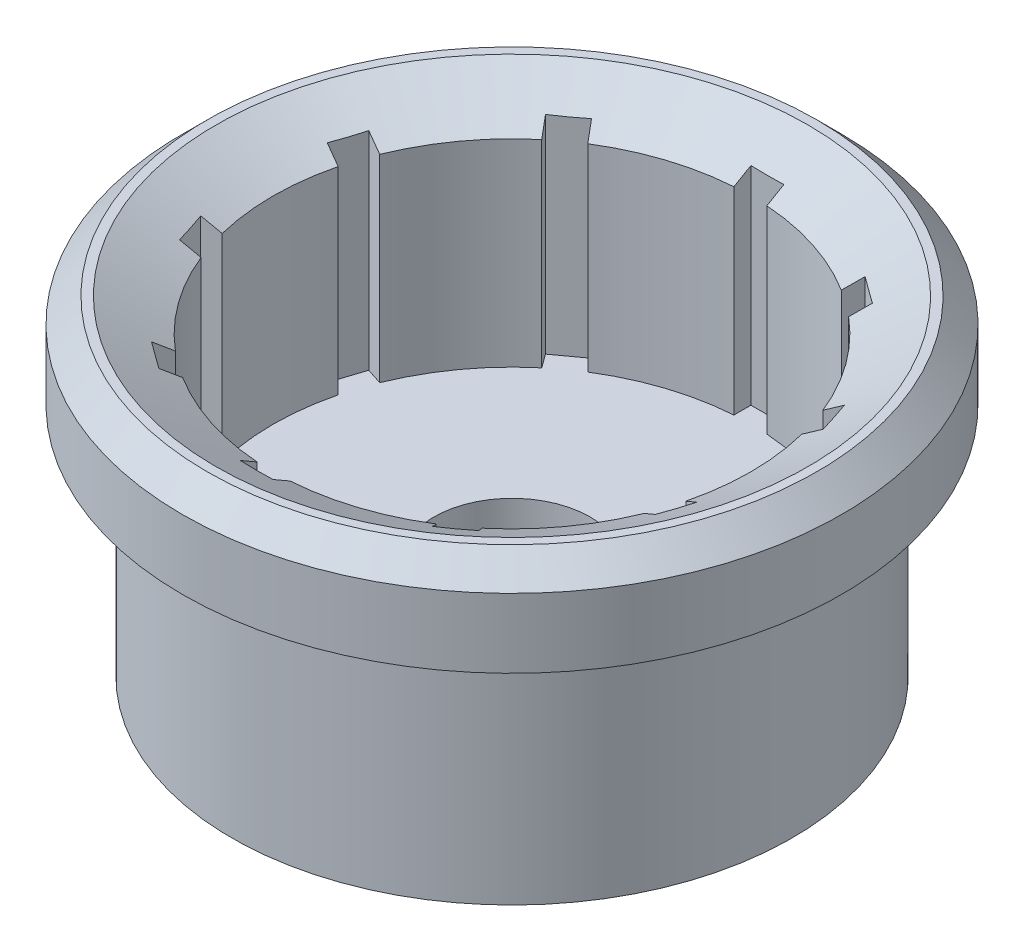
from build123d import *

# Parameters (mm, degrees)
CHAMFER_1_SIZE           = 2
CHAMFER_1_SIZE2          = 3.464101615
CHAMFER_2_SIZE           = 1.5
SKETCH_2_W               = 2
SKETCH_2_H               = 31
CUT_EXTRUDE_1_DEPTH      = 32.559467676
PATTERN_CIRCULAR_1_COUNT = 10
CHAMFER_3_SIZE           = 1
CHAMFER_4_SIZE           = 0.2
CUT_EXTRUDE_2_DEPTH      = 0.3


with BuildPart() as part:
    # 草图1 → 旋转1 (revolve)
    with BuildSketch(Plane.XY, mode=Mode.PRIVATE) as revolve_1_sk:
        Polygon((-2.5, 0), (-2.5, 8), (-4.75, 8), (-4.75, 12), (-14.5, 12), (-14.5, 26), (-20, 26), (-20, 20.3), (-17, 20.3), (-17, 6), (-6.5, 6), (-6.5, 5), (-4.5, 5), (-4.5, 0), align=None)
    revolve(revolve_1_sk.sketch.rotate(Axis((0, 0, 0), (0, 1, 0)), 270), axis=Axis((0, 0, 0), (0, 1, 0)))

    # 倒角1
    chamfer_1_edges = [part.edges().sort_by_distance(p)[0] for p in [
        (0, 26, 14.5),
    ]]
    chamfer_1_side = [part.faces().sort_by_distance(p)[0] for p in [
        (0, 19, 14.5),
    ]]
    chamfer(chamfer_1_edges, length=CHAMFER_1_SIZE, length2=CHAMFER_1_SIZE2, reference=chamfer_1_side[0])

    # 倒角2
    chamfer_2_edges = [part.edges().sort_by_distance(p)[0] for p in [
        (0, 26, 20),
    ]]
    chamfer(chamfer_2_edges, length=CHAMFER_2_SIZE)

    # 草图2 → 切除-拉伸1 (cut, through all)
    with BuildSketch(Plane(origin=(0, 12, 0), x_dir=(1, 0, 0), z_dir=(0, 1, 0))):
        Rectangle(SKETCH_2_W, SKETCH_2_H)
    cut_extrude_1 = extrude(amount=CUT_EXTRUDE_1_DEPTH, mode=Mode.SUBTRACT)

    # 阵列(圆周)1: 切除-拉伸1 ×10 about axis
    pattern_circular_1_axis = Axis((0, 0, 0), (0, 1, 0))
    for i in range(1, PATTERN_CIRCULAR_1_COUNT):
        add(cut_extrude_1.rotate(pattern_circular_1_axis, i * 360 / PATTERN_CIRCULAR_1_COUNT), mode=Mode.SUBTRACT)

    # 倒角3
    chamfer_3_edges = [part.edges().sort_by_distance(p)[0] for p in [
        (0, 0, 4.5),
    ]]
    chamfer(chamfer_3_edges, length=CHAMFER_3_SIZE)

    # 倒角4
    chamfer_4_edges = [part.edges().sort_by_distance(p)[0] for p in [
        (0, 5, 6.5),
    ]]
    chamfer(chamfer_4_edges, length=CHAMFER_4_SIZE)

    # 草图3 → 切除-拉伸2 (cut)
    # profile 1 of 12: a face of its own
    with BuildSketch(Plane(origin=(0, 12, 0), x_dir=(1, 0, 0), z_dir=(0, 1, 0))):
        Polygon((3.14620718, 6.849376504), (2.409069223, 7.132341443), (2.945559314, 8.529730924), (3.126199558, 8.460275894), (2.651161448, 7.222661565), (3.207659162, 7.009151656), align=None)
    # profile 2 of 12: a face of its own
    with BuildSketch(Plane(origin=(0, 12, 0), x_dir=(1, 0, 0), z_dir=(0, 1, 0))):
        with BuildLine():
            add(Edge.make_bspline(
                [(4.357208409, 6.263600457), (4.335849155, 6.264257805), (4.29320875, 6.265570096), (4.229569589, 6.27283597), (4.166536035, 6.284776925), (4.103718409, 6.300367689), (4.041417444, 6.320793385), (3.979583811, 6.345461461), (3.918161426, 6.374319693), (3.878324794, 6.396642357), (3.858161152, 6.407941159)],
                knots=[0, 0, 0, 0, 0.975863205, 1.94815813, 2.92212701, 3.904856651, 4.902687482, 5.914533597, 6.94442389, 8, 8, 8, 8], degree=3))
            add(Edge.make_bspline(
                [(3.858161152, 6.407941159), (3.835687339, 6.421729576), (3.791775473, 6.448670936), (3.731743833, 6.495219681), (3.678015999, 6.544837572), (3.631130188, 6.598339251), (3.590769065, 6.65525821), (3.557123824, 6.71580237), (3.530511187, 6.780131335), (3.510216582, 6.847317171), (3.497124085, 6.91668572), (3.491262714, 6.987009404), (3.493406481, 7.057921694), (3.503035969, 7.12930458), (3.519639116, 7.201437133), (3.544184082, 7.27392872), (3.576416165, 7.346868778), (3.602641742, 7.394318299), (3.616068927, 7.41861189)],
                knots=[0, 0, 0, 0, 1.079629307, 2.109501173, 3.106617786, 4.072054532, 5.018674735, 5.960501731, 6.903686851, 7.865739862, 8.831176608, 9.790755451, 10.751445286, 11.731956575, 12.737595058, 13.779470977, 14.863115492, 16, 16, 16, 16], degree=3))
            add(Edge.make_bspline(
                [(3.616068927, 7.41861189), (3.630785411, 7.442625271), (3.659709664, 7.489821942), (3.709685155, 7.554382582), (3.763385035, 7.612232114), (3.820833922, 7.663565754), (3.882365513, 7.70803157), (3.948101538, 7.745369421), (4.017571712, 7.776174014), (4.090536746, 7.799582213), (4.165215815, 7.816369617), (4.240564952, 7.824583343), (4.315638193, 7.82516334), (4.390614353, 7.818152632), (4.465330656, 7.802326751), (4.539893868, 7.779060226), (4.614367754, 7.747915076), (4.662131573, 7.721386503), (4.686476701, 7.707864939)],
                knots=[0, 0, 0, 0, 1.086340946, 2.135129459, 3.144621878, 4.129120064, 5.103721325, 6.068800588, 7.04175647, 8.03132997, 9.021641019, 9.990921207, 10.950668867, 11.914780941, 12.891225611, 13.892588733, 14.925856483, 16, 16, 16, 16], degree=3))
            add(Edge.make_bspline(
                [(4.686476701, 7.707864939), (4.703433924, 7.697726322), (4.736654389, 7.677864014), (4.784004752, 7.646042212), (4.827898328, 7.612994897), (4.869317113, 7.579912286), (4.906766954, 7.544977742), (4.941417665, 7.509612211), (4.973106606, 7.473449245), (4.991721465, 7.447999672), (5.000882189, 7.435475457)],
                knots=[0, 0, 0, 0, 1.131230688, 2.216165348, 3.264757557, 4.277011034, 5.249936384, 6.195163007, 7.111805634, 8, 8, 8, 8], degree=3))
            Line((5.000882189, 7.435475457), (4.895985085, 7.255978506))
            add(Edge.make_bspline(
                [(4.895985085, 7.255978506), (4.887471819, 7.2714697), (4.870465118, 7.302416005), (4.840286147, 7.346314799), (4.80686702, 7.38843394), (4.76955521, 7.428522829), (4.728585366, 7.466533781), (4.684017586, 7.502605416), (4.636171507, 7.537054873), (4.602023747, 7.557658901), (4.584723652, 7.568097409)],
                knots=[0, 0, 0, 0, 0.949194624, 1.89617828, 2.857891985, 3.835843193, 4.835497204, 5.857995623, 6.914807918, 8, 8, 8, 8], degree=3))
            add(Edge.make_bspline(
                [(4.584723652, 7.568097409), (4.567367151, 7.577692369), (4.533212737, 7.596573493), (4.479843527, 7.61837278), (4.426356606, 7.635061349), (4.372373632, 7.645385959), (4.318028763, 7.649653636), (4.263429429, 7.648184667), (4.208513871, 7.641036521), (4.153895406, 7.62776818), (4.100258228, 7.609403321), (4.048818775, 7.585219211), (3.999955448, 7.555616632), (3.953860268, 7.520477047), (3.910137001, 7.480351619), (3.869551887, 7.434404602), (3.831041595, 7.383568308), (3.808314172, 7.346597853), (3.796709171, 7.327720122)],
                knots=[0, 0, 0, 0, 1.027964646, 2.022846102, 2.984268154, 3.930260357, 4.867250688, 5.806571084, 6.758560005, 7.73429244, 8.717369047, 9.694564734, 10.67689572, 11.675208235, 12.696486531, 13.750031017, 14.85112835, 16, 16, 16, 16], degree=3))
            add(Edge.make_bspline(
                [(3.796709171, 7.327720122), (3.785651912, 7.307863013), (3.764114772, 7.269185675), (3.73747965, 7.210147691), (3.716649105, 7.152266628), (3.701927728, 7.095326852), (3.692951662, 7.039343576), (3.689650688, 6.984363018), (3.692495433, 6.930374847), (3.701412044, 6.877872417), (3.715709829, 6.827188121), (3.735172983, 6.778778689), (3.760277324, 6.733129534), (3.790478666, 6.690016999), (3.82589617, 6.649554336), (3.866389521, 6.611740688), (3.912195443, 6.576574404), (3.945616808, 6.555988908), (3.962772433, 6.545422104)],
                knots=[0, 0, 0, 0, 1.20418438, 2.345489834, 3.428362659, 4.460813323, 5.457846323, 6.428955382, 7.374575895, 8.316792747, 9.245544773, 10.160731388, 11.075945864, 12.000515416, 12.945340139, 13.920641244, 14.932637904, 16, 16, 16, 16], degree=3))
            add(Edge.make_bspline(
                [(3.962772433, 6.545422104), (3.974879196, 6.538488816), (3.998639231, 6.524881944), (4.035132715, 6.507716321), (4.070793565, 6.492215245), (4.106437439, 6.480077875), (4.141584938, 6.469895685), (4.17654503, 6.46249132), (4.211114154, 6.457455491), (4.234098395, 6.456262775), (4.245451549, 6.455673628)],
                knots=[0, 0, 0, 0, 1.116967907, 2.192096805, 3.228169125, 4.229689744, 5.205560439, 6.157446739, 7.08986374, 8, 8, 8, 8], degree=3))
            Line((4.245451549, 6.455673628), (4.448957646, 6.80380625))
            Line((4.448957646, 6.80380625), (4.169994232, 6.96701128))
            Line((4.169994232, 6.96701128), (4.256027006, 7.114210213))
            Line((4.256027006, 7.114210213), (4.701911152, 6.853539482))
            Line((4.701911152, 6.853539482), (4.357208409, 6.263600457))
        make_face()
    # profile 3 of 12: a face of its own
    with BuildSketch(Plane(origin=(0, 12, 0), x_dir=(1, 0, 0), z_dir=(0, 1, 0))):
        with BuildLine():
            Line((5.400150092, 5.26752716), (5.227227074, 5.415583563))
            Line((5.227227074, 5.415583563), (5.308686677, 5.892050788))
            add(Edge.make_bspline(
                [(5.308686677, 5.892050788), (5.310552499, 5.903570512), (5.31416989, 5.925904567), (5.318500979, 5.95839084), (5.321436018, 5.988707279), (5.322818407, 6.01684387), (5.323239085, 6.042879642), (5.322180045, 6.066851899), (5.319563936, 6.088705516), (5.314788571, 6.114898563), (5.304796259, 6.145512805), (5.286794322, 6.179501359), (5.262991576, 6.211401983), (5.243176633, 6.229627733), (5.232943537, 6.239040118)],
                knots=[0, 0, 0, 0, 1.120456416, 2.172303337, 3.146283936, 4.043942091, 4.876449295, 5.645741822, 6.345838471, 6.988147234, 8.200267024, 9.419648688, 10.667420656, 12, 12, 12, 12], degree=3))
            Line((5.232943537, 6.239040118), (5.127474787, 6.329646063))
            Line((5.127474787, 6.329646063), (4.718176007, 5.852035544))
            Line((4.718176007, 5.852035544), (4.571834543, 5.977226093))
            Line((4.571834543, 5.977226093), (5.54420497, 7.111658258))
            Line((5.54420497, 7.111658258), (5.889765183, 6.815545453))
            add(Edge.make_bspline(
                [(5.889765183, 6.815545453), (5.902981642, 6.80381054), (5.928748157, 6.780932415), (5.963681936, 6.744582797), (5.994161043, 6.707593412), (6.020313684, 6.67005747), (6.042260957, 6.631996743), (6.05949646, 6.593164982), (6.072469949, 6.553819195), (6.081123484, 6.514072748), (6.085163537, 6.474274706), (6.084585442, 6.434762248), (6.079508824, 6.395668762), (6.069300788, 6.35715312), (6.054614457, 6.31920285), (6.035240688, 6.281919337), (6.01141251, 6.244975409), (5.992425741, 6.221806002), (5.982657714, 6.209886154)],
                knots=[0, 0, 0, 0, 1.221258081, 2.380937626, 3.480422159, 4.530790761, 5.539524127, 6.512368191, 7.461955993, 8.398368965, 9.31833679, 10.220599372, 11.123990698, 12.03600517, 12.967868817, 13.930946562, 14.935544522, 16, 16, 16, 16], degree=3))
            add(Edge.make_bspline(
                [(5.982657714, 6.209886154), (5.974232602, 6.20040567), (5.957743712, 6.181851296), (5.930931212, 6.156958142), (5.903466925, 6.134821026), (5.875206978, 6.115632883), (5.846057226, 6.099396541), (5.815971226, 6.086316513), (5.785072307, 6.075747649), (5.753065302, 6.069179131), (5.720412991, 6.064635078), (5.686816019, 6.063695732), (5.652383897, 6.065311449), (5.617149894, 6.070376505), (5.580999843, 6.078036394), (5.544122397, 6.089106137), (5.506290132, 6.102765053), (5.481259266, 6.113882207), (5.46846183, 6.119566032)],
                knots=[0, 0, 0, 0, 1.071071041, 2.096206428, 3.08684952, 4.049123387, 4.978756645, 5.901533695, 6.817933689, 7.732103608, 8.657685245, 9.600056644, 10.567233763, 11.566765521, 12.604059882, 13.6865946, 14.817233977, 16, 16, 16, 16], degree=3))
            Line((5.46846183, 6.119566032), (5.465603598, 6.116136154))
            add(Edge.make_bspline(
                [(5.465603598, 6.116136154), (5.470221675, 6.10603328), (5.479367061, 6.086026102), (5.488875488, 6.054580565), (5.495768739, 6.022681511), (5.497988049, 5.995177697), (5.498238876, 5.971893377), (5.498138608, 5.952142436), (5.496323287, 5.930258775), (5.494972334, 5.906193751), (5.491755532, 5.880038614), (5.488517108, 5.851612515), (5.484176137, 5.821028498), (5.480787471, 5.800010079), (5.479037287, 5.789154447)],
                knots=[0, 0, 0, 0, 1.199103468, 2.374638546, 3.541712358, 4.719904422, 5.348013318, 6.058476303, 6.852898143, 7.719922151, 8.662451062, 9.699385696, 10.811774489, 12, 12, 12, 12], degree=3))
            Line((5.479037287, 5.789154447), (5.400150092, 5.26752716))
        make_face()
        with BuildLine():
            Line((5.580790336, 6.858418929), (5.237230885, 6.457694843))
            Line((5.237230885, 6.457694843), (5.410153903, 6.309352618))
            add(Edge.make_bspline(
                [(5.410153903, 6.309352618), (5.418437339, 6.302552411), (5.434730092, 6.289177034), (5.460389316, 6.271756565), (5.486601418, 6.257281162), (5.513284666, 6.245899086), (5.54020258, 6.236918715), (5.567480271, 6.230763589), (5.595205465, 6.228067921), (5.623047105, 6.22770595), (5.650783532, 6.230153673), (5.677654981, 6.236018145), (5.7036544, 6.244308644), (5.72861771, 6.255469198), (5.752409978, 6.269707434), (5.775527041, 6.286351542), (5.797480306, 6.306077127), (5.810912019, 6.32094647), (5.817737744, 6.32850277)],
                knots=[0, 0, 0, 0, 1.120339998, 2.203604986, 3.238120769, 4.246789005, 5.232964375, 6.202337217, 7.163998956, 8.14046306, 9.111063992, 10.068587754, 11.010695653, 11.960621139, 12.920939991, 13.905453055, 14.935593528, 16, 16, 16, 16], degree=3))
            add(Edge.make_bspline(
                [(5.817737744, 6.32850277), (5.823808728, 6.335811574), (5.835609036, 6.350017862), (5.850234609, 6.372961135), (5.862263737, 6.39598498), (5.871630677, 6.419410456), (5.877881375, 6.44312588), (5.881411373, 6.467194681), (5.881941016, 6.491568489), (5.879639684, 6.516214777), (5.874426814, 6.540942658), (5.866368677, 6.565559703), (5.855474366, 6.590059301), (5.841182976, 6.614087572), (5.824368371, 6.638236629), (5.804085173, 6.661866457), (5.78131985, 6.685693881), (5.764403418, 6.700669421), (5.755714116, 6.708361764)],
                knots=[0, 0, 0, 0, 1.041946852, 2.025255679, 2.979384037, 3.890119977, 4.788038229, 5.665008742, 6.554115262, 7.457315611, 8.376120575, 9.321903206, 10.295544947, 11.312475691, 12.385904317, 13.521315497, 14.726797784, 16, 16, 16, 16], degree=3))
            Line((5.755714116, 6.708361764), (5.580790336, 6.858418929))
        make_face(mode=Mode.SUBTRACT)
    # profile 4 of 12: a face of its own
    with BuildSketch(Plane(origin=(0, 12, 0), x_dir=(1, 0, 0), z_dir=(0, 1, 0))):
        with BuildLine():
            add(Edge.make_bspline(
                [(7.178616352, 4.796926463), (7.186431862, 4.802902439), (7.201693328, 4.814571818), (7.222440987, 4.833738976), (7.240182732, 4.854177975), (7.255481465, 4.875318721), (7.26796126, 4.897527649), (7.277405439, 4.920905127), (7.28423755, 4.945259011), (7.288615954, 4.970447389), (7.289902697, 4.996234113), (7.28887147, 5.022297514), (7.284733758, 5.048533097), (7.277947887, 5.074809956), (7.267868647, 5.101055148), (7.255711542, 5.127645455), (7.24047132, 5.154248299), (7.228664263, 5.17143581), (7.22263312, 5.180215335)],
                knots=[0, 0, 0, 0, 1.081742489, 2.112335041, 3.100057938, 4.053847712, 4.977993258, 5.894503079, 6.820013993, 7.755437585, 8.699972661, 9.65445292, 10.619231154, 11.615532279, 12.633475098, 13.707117586, 14.828776506, 16, 16, 16, 16], degree=3))
            add(Edge.make_bspline(
                [(7.22263312, 5.180215335), (7.213017006, 5.19247759), (7.19357558, 5.217268866), (7.158487518, 5.250230059), (7.118426583, 5.279688884), (7.073863927, 5.305873434), (7.025336659, 5.328364271), (6.973316103, 5.346768938), (6.918027124, 5.360427176), (6.879890732, 5.366205623), (6.860495162, 5.369144451)],
                knots=[0, 0, 0, 0, 0.889993607, 1.799348997, 2.741780266, 3.72836241, 4.749544964, 5.795363465, 6.878756511, 8, 8, 8, 8], degree=3))
            Line((6.860495162, 5.369144451), (7.009694858, 5.476899786))
            add(Edge.make_bspline(
                [(7.009694858, 5.476899786), (7.026909055, 5.473870716), (7.061028533, 5.467866935), (7.110642863, 5.453580612), (7.157837521, 5.434153014), (7.203193838, 5.410313946), (7.246682627, 5.38099312), (7.288114954, 5.345272806), (7.3280283, 5.303557943), (7.351855669, 5.271940703), (7.364115589, 5.255672652)],
                knots=[0, 0, 0, 0, 0.974703229, 1.931915014, 2.873592798, 3.817563103, 4.786159838, 5.792805615, 6.864330047, 8, 8, 8, 8], degree=3))
            add(Edge.make_bspline(
                [(7.364115589, 5.255672652), (7.3735781, 5.242095473), (7.392071883, 5.21555987), (7.415505532, 5.174209936), (7.434860344, 5.132967541), (7.449750333, 5.091599134), (7.460791216, 5.0503233), (7.467438811, 5.008948573), (7.469649275, 4.96757641), (7.468037496, 4.926490392), (7.462137254, 4.886299614), (7.451724472, 4.847567653), (7.437118586, 4.810663914), (7.41832767, 4.775318702), (7.395115502, 4.741914231), (7.367555508, 4.710394893), (7.33648225, 4.679950789), (7.312793297, 4.662231144), (7.300662845, 4.653157408)],
                knots=[0, 0, 0, 0, 1.162112506, 2.271263818, 3.334319757, 4.359073078, 5.355903541, 6.331956145, 7.297278132, 8.261950165, 9.216115763, 10.144822203, 11.073287415, 11.998538303, 12.951012117, 13.923846451, 14.936859778, 16, 16, 16, 16], degree=3))
            add(Edge.make_bspline(
                [(7.300662845, 4.653157408), (7.289524173, 4.64537523), (7.267598475, 4.630056557), (7.233371344, 4.610145508), (7.199121509, 4.592529362), (7.164378191, 4.577993517), (7.129575624, 4.56588352), (7.094390521, 4.556709146), (7.059063315, 4.550101514), (7.023125169, 4.546271198), (6.986056441, 4.545665156), (6.947100654, 4.546977976), (6.905950591, 4.551350448), (6.862811099, 4.558739135), (6.817446588, 4.568064443), (6.770113696, 4.580522315), (6.72053359, 4.595378683), (6.687056234, 4.60692322), (6.669851108, 4.612856341)],
                knots=[0, 0, 0, 0, 0.983614458, 1.936176235, 2.864953104, 3.770923759, 4.661151952, 5.531370031, 6.401506051, 7.261738209, 8.145122211, 9.084093961, 10.083003842, 11.139017123, 12.252668299, 13.435794037, 14.682169272, 16, 16, 16, 16], degree=3))
            add(Edge.make_bspline(
                [(6.669851108, 4.612856341), (6.652622724, 4.61900058), (6.619558908, 4.630792284), (6.571849154, 4.64697496), (6.528403887, 4.661551126), (6.48922953, 4.6745686), (6.454029071, 4.685404457), (6.422953601, 4.694497034), (6.396066459, 4.702156243), (6.36624655, 4.709108242), (6.333405244, 4.715851184), (6.29686169, 4.719879192), (6.263531905, 4.720746619), (6.232766031, 4.717649002), (6.203523647, 4.710417724), (6.174427593, 4.699541662), (6.145183645, 4.683800135), (6.126291926, 4.670961004), (6.116497449, 4.664304512)],
                knots=[0, 0, 0, 0, 1.509090125, 2.896167038, 4.156438176, 5.289945174, 6.301887477, 7.19485197, 7.96149132, 8.607830754, 9.720874861, 10.725217223, 11.637181267, 12.467060134, 13.267799343, 14.116051421, 15.023260314, 16, 16, 16, 16], degree=3))
            Line((6.116497449, 4.664304512), (6.553235254, 4.058931036))
            Line((6.553235254, 4.058931036), (6.416325955, 3.960322042))
            Line((6.416325955, 3.960322042), (5.864115589, 4.726042317))
            Line((5.864115589, 4.726042317), (5.924710102, 4.769773262))
            add(Edge.make_bspline(
                [(5.924710102, 4.769773262), (5.941872643, 4.781577443), (5.974961161, 4.804335312), (6.025677318, 4.832798674), (6.075043573, 4.854764096), (6.123756963, 4.870767955), (6.17339065, 4.880433671), (6.224996959, 4.885425879), (6.279450359, 4.884459532), (6.32675887, 4.880010679), (6.366991918, 4.873579191), (6.400024682, 4.866883062), (6.435736219, 4.858957936), (6.473766373, 4.848780792), (6.514633045, 4.83743776), (6.557798361, 4.823869269), (6.603685097, 4.809079045), (6.634906428, 4.79822792), (6.650986778, 4.792639116)],
                knots=[0, 0, 0, 0, 1.307349237, 2.520503647, 3.645349094, 4.695247638, 5.732303898, 6.813831342, 7.944467436, 9.146227272, 9.794314972, 10.501719707, 11.26214649, 12.090608025, 12.973090491, 13.924809046, 14.931185887, 16, 16, 16, 16], degree=3))
            add(Edge.make_bspline(
                [(6.650986778, 4.792639116), (6.667426032, 4.786977145), (6.699286453, 4.776003852), (6.746146961, 4.762328211), (6.789929878, 4.749910971), (6.831119276, 4.740684021), (6.869390873, 4.733055111), (6.904876032, 4.727851315), (6.937510744, 4.724891939), (6.967798692, 4.724184657), (6.996358695, 4.725992237), (7.024096582, 4.729642027), (7.051211251, 4.735719093), (7.077857261, 4.743748653), (7.104025639, 4.753702928), (7.129482738, 4.766227617), (7.154666386, 4.780290567), (7.170603541, 4.791360681), (7.178616352, 4.796926463)],
                knots=[0, 0, 0, 0, 1.512144648, 2.930641731, 4.245516401, 5.469833733, 6.60105252, 7.639457345, 8.587845682, 9.449891802, 10.271847115, 11.074696372, 11.881002799, 12.685902542, 13.493910757, 14.313062111, 15.151849044, 16, 16, 16, 16], degree=3))
        make_face()
    # profile 5 of 12: a face of its own
    with BuildSketch(Plane(origin=(0, 12, 0), x_dir=(1, 0, 0), z_dir=(0, 1, 0))):
        with BuildLine():
            add(Edge.make_bspline(
                [(7.143258524, 4.12510611), (7.17179784, 4.139311898), (7.2272435, 4.166910643), (7.310147788, 4.20217453), (7.389373317, 4.231732217), (7.46521233, 4.254370456), (7.5375559, 4.270953399), (7.606455304, 4.2812101), (7.67201571, 4.284767255), (7.733995398, 4.282075531), (7.792359463, 4.273093946), (7.846851222, 4.257522272), (7.897500951, 4.236154508), (7.944093348, 4.208304379), (7.986767641, 4.174433282), (8.024826943, 4.13376623), (8.059662041, 4.087572279), (8.078517785, 4.053060574), (8.088189926, 4.035357634)],
                knots=[0, 0, 0, 0, 1.429814779, 2.777817934, 4.039422015, 5.221281753, 6.325531087, 7.366364123, 8.342178659, 9.266345595, 10.144675598, 10.984780368, 11.802450676, 12.603601144, 13.412590923, 14.237910449, 15.096128014, 16, 16, 16, 16], degree=3))
            add(Edge.make_bspline(
                [(8.088189926, 4.035357634), (8.096417518, 4.018095114), (8.112482374, 3.984389028), (8.129060596, 3.932120941), (8.13870674, 3.88037252), (8.14146647, 3.829202561), (8.136675077, 3.778537794), (8.125285414, 3.728467846), (8.106179675, 3.679171039), (8.080675856, 3.630330894), (8.047513889, 3.582384298), (8.007679094, 3.534960431), (7.960711695, 3.488335337), (7.906905973, 3.442282189), (7.846288651, 3.396510393), (7.778186608, 3.35193173), (7.703721429, 3.307114257), (7.650747453, 3.279366874), (7.623441451, 3.265064189)],
                knots=[0, 0, 0, 0, 0.902711789, 1.762597846, 2.581961311, 3.384267805, 4.175331684, 4.97903875, 5.802546671, 6.6663476, 7.576570753, 8.551214234, 9.58890626, 10.699713916, 11.895341478, 13.175076121, 14.543862819, 16, 16, 16, 16], degree=3))
            add(Edge.make_bspline(
                [(7.623441451, 3.265064189), (7.596056067, 3.251405171), (7.542948874, 3.224916875), (7.463199391, 3.191625072), (7.386821031, 3.163813107), (7.313305509, 3.142510969), (7.242707613, 3.127536952), (7.175163751, 3.118286191), (7.11054352, 3.11602325), (7.049160306, 3.119572871), (6.991299895, 3.129106505), (6.93723107, 3.144893682), (6.887338557, 3.166695893), (6.841262557, 3.194040117), (6.799452138, 3.227551883), (6.761925358, 3.267115431), (6.728065906, 3.312231838), (6.709648103, 3.345704117), (6.700232609, 3.362815714)],
                knots=[0, 0, 0, 0, 1.40628124, 2.727135447, 3.969674515, 5.140865063, 6.241962802, 7.284341225, 8.270292578, 9.209177269, 10.106226679, 10.959830076, 11.791332092, 12.602449397, 13.415632886, 14.245726808, 15.103185786, 16, 16, 16, 16], degree=3))
            add(Edge.make_bspline(
                [(6.700232609, 3.362815714), (6.692277197, 3.379504906), (6.676753665, 3.412070809), (6.661101789, 3.462973114), (6.651642154, 3.513523102), (6.649425614, 3.564008925), (6.653689507, 3.614289883), (6.66504895, 3.664440606), (6.683332937, 3.714342883), (6.708060858, 3.764059979), (6.739741278, 3.812841325), (6.777782327, 3.860917183), (6.822693864, 3.907718395), (6.873882724, 3.95368912), (6.931787158, 3.998416389), (6.996231543, 4.041871902), (7.066904089, 4.08508028), (7.117276792, 4.111486202), (7.143258524, 4.12510611)],
                knots=[0, 0, 0, 0, 0.893706791, 1.743905234, 2.568706748, 3.376436033, 4.181687453, 5.003868638, 5.85711225, 6.747900271, 7.685386613, 8.666876589, 9.71050313, 10.820562333, 11.99370477, 13.248260815, 14.580680689, 16, 16, 16, 16], degree=3))
        make_face()
        with BuildLine():
            add(Edge.make_bspline(
                [(7.238723463, 3.957613732), (7.217471163, 3.946556296), (7.176254865, 3.92511172), (7.118079349, 3.890949706), (7.06472309, 3.857341094), (7.016617031, 3.823729768), (6.973848602, 3.789951699), (6.936227228, 3.756250798), (6.903717205, 3.722517908), (6.876360937, 3.688725889), (6.854020632, 3.654976589), (6.837315139, 3.62103631), (6.825525611, 3.587177621), (6.81916594, 3.553168571), (6.817973714, 3.519143425), (6.822088373, 3.485121566), (6.831512604, 3.45116437), (6.841675008, 3.429569168), (6.846859896, 3.418551232)],
                knots=[0, 0, 0, 0, 1.549219029, 3.004525211, 4.361860669, 5.626932786, 6.798131876, 7.884563089, 8.891322021, 9.824809896, 10.693050055, 11.503262996, 12.265195215, 13.004849279, 13.732391473, 14.458496996, 15.21352062, 16, 16, 16, 16], degree=3))
            add(Edge.make_bspline(
                [(6.846859896, 3.418551232), (6.852787034, 3.408094219), (6.864368695, 3.387661157), (6.885931813, 3.360361511), (6.91126276, 3.337859224), (6.939454364, 3.319379824), (6.970915494, 3.305230958), (7.00535845, 3.295325017), (7.043010196, 3.289520841), (7.083745878, 3.288896483), (7.127584373, 3.29122906), (7.174427329, 3.298881505), (7.224473716, 3.309994309), (7.277621506, 3.325545455), (7.333758851, 3.345579452), (7.393154599, 3.369202734), (7.455636388, 3.397399158), (7.497847307, 3.418496531), (7.51968764, 3.429412513)],
                knots=[0, 0, 0, 0, 0.77109393, 1.506721783, 2.221502861, 2.937513187, 3.66299891, 4.427660041, 5.232263792, 6.101263405, 7.038826513, 8.047604388, 9.144391837, 10.32918929, 11.600305431, 12.970264084, 14.432385748, 16, 16, 16, 16], degree=3))
            add(Edge.make_bspline(
                [(7.51968764, 3.429412513), (7.542074185, 3.441056162), (7.58544157, 3.463612329), (7.646861361, 3.49912577), (7.703017633, 3.534300916), (7.753939223, 3.568946131), (7.799381283, 3.603656101), (7.839454188, 3.638125481), (7.874259367, 3.672399809), (7.903676861, 3.706573777), (7.927985466, 3.74044558), (7.946403084, 3.774509853), (7.960029542, 3.808067943), (7.967470367, 3.841776441), (7.969980618, 3.875242553), (7.966584838, 3.908484606), (7.9584468, 3.941733454), (7.948612065, 3.962614645), (7.943563402, 3.973334006)],
                knots=[0, 0, 0, 0, 1.587305033, 3.074939262, 4.461892257, 5.755331622, 6.948158153, 8.057270401, 9.07869912, 10.018120988, 10.891181346, 11.695780691, 12.449308928, 13.161840473, 13.858772828, 14.551205962, 15.256261376, 16, 16, 16, 16], degree=3))
            add(Edge.make_bspline(
                [(7.943563402, 3.973334006), (7.937497528, 3.984211934), (7.925682638, 4.005399568), (7.902819372, 4.033302518), (7.876888386, 4.056862902), (7.847246635, 4.075784335), (7.814525151, 4.090391026), (7.778305259, 4.100437612), (7.738889834, 4.105526035), (7.696285734, 4.107015914), (7.650441284, 4.103655512), (7.601294666, 4.095632627), (7.548880072, 4.083616571), (7.493088183, 4.067078231), (7.434089953, 4.046148889), (7.371715174, 4.020785576), (7.305906053, 3.991478844), (7.261593266, 3.969141845), (7.238723463, 3.957613732)],
                knots=[0, 0, 0, 0, 0.762744968, 1.48564708, 2.201546116, 2.903497027, 3.633381818, 4.392018313, 5.200353088, 6.065805498, 7.003103525, 8.014862696, 9.117875961, 10.299599208, 11.582396876, 12.956346003, 14.429171912, 16, 16, 16, 16], degree=3))
        make_face(mode=Mode.SUBTRACT)
    # profile 6 of 12: a face of its own
    with BuildSketch(Plane(origin=(0, 12, 0), x_dir=(1, 0, 0), z_dir=(0, 1, 0))):
        with BuildLine():
            add(Edge.make_bspline(
                [(8.279054551, 2.41894148), (8.288279372, 2.422180763), (8.306316558, 2.428514495), (8.331355666, 2.440962781), (8.354370472, 2.454715468), (8.374838666, 2.470495287), (8.393472575, 2.48769869), (8.409473892, 2.506994823), (8.423312043, 2.527976037), (8.434673788, 2.550657463), (8.443939833, 2.574534749), (8.450030632, 2.599642452), (8.454290403, 2.625439766), (8.45512588, 2.652270581), (8.454213097, 2.680032622), (8.449865248, 2.708647821), (8.44378607, 2.738362323), (8.437494503, 2.758073165), (8.434256533, 2.768217395)],
                knots=[0, 0, 0, 0, 1.083993294, 2.119519614, 3.096846741, 4.054766314, 4.982271719, 5.905488827, 6.829190118, 7.765392295, 8.71575547, 9.664529458, 10.627511728, 11.611677378, 12.638096181, 13.705672257, 14.819218933, 16, 16, 16, 16], degree=3))
            add(Edge.make_bspline(
                [(8.434256533, 2.768217395), (8.428811264, 2.782673984), (8.41778079, 2.811958675), (8.394164166, 2.853363698), (8.365292854, 2.893302522), (8.330622045, 2.930876954), (8.291585057, 2.966819455), (8.24750246, 2.99913764), (8.199753962, 3.02940891), (8.16520058, 3.045909773), (8.147575893, 3.054326389)],
                knots=[0, 0, 0, 0, 0.889679982, 1.802223447, 2.738571706, 3.726469569, 4.745414086, 5.793724044, 6.874641995, 8, 8, 8, 8], degree=3))
            Line((8.147575893, 3.054326389), (8.320784734, 3.112062669))
            add(Edge.make_bspline(
                [(8.320784734, 3.112062669), (8.336173641, 3.104130955), (8.366671168, 3.08841199), (8.409600821, 3.060370947), (8.448416522, 3.02775501), (8.484380087, 2.991809187), (8.51678039, 2.951137414), (8.544904693, 2.90497743), (8.570146671, 2.853772573), (8.583257264, 2.816960185), (8.590030161, 2.797943005)],
                knots=[0, 0, 0, 0, 0.974669271, 1.931586396, 2.880345253, 3.825089984, 4.791289063, 5.800854309, 6.863927225, 8, 8, 8, 8], degree=3))
            add(Edge.make_bspline(
                [(8.590030161, 2.797943005), (8.594948482, 2.782291467), (8.604574768, 2.751657804), (8.614485507, 2.705551639), (8.620654251, 2.660738329), (8.62270871, 2.617207967), (8.620752573, 2.574899743), (8.614737453, 2.533821064), (8.60474022, 2.493962255), (8.590716384, 2.455660963), (8.573128209, 2.419525599), (8.552053, 2.385903249), (8.527461253, 2.355240257), (8.499046199, 2.327555525), (8.467340988, 2.30270751), (8.432049396, 2.280839683), (8.393358858, 2.26186756), (8.365765771, 2.251948771), (8.351653637, 2.246875931)],
                knots=[0, 0, 0, 0, 1.162320237, 2.274928325, 3.337880318, 4.36540657, 5.359205362, 6.335224898, 7.303174915, 8.266662624, 9.221019795, 10.146559149, 11.073575429, 11.999976609, 12.952348748, 13.922980398, 14.937734641, 16, 16, 16, 16], degree=3))
            add(Edge.make_bspline(
                [(8.351653637, 2.246875931), (8.338845606, 2.242774694), (8.313551771, 2.2346754), (8.275266006, 2.226083777), (8.237704288, 2.219511332), (8.200614041, 2.216294373), (8.164143311, 2.21488331), (8.128131058, 2.216775104), (8.092737218, 2.220875384), (8.0576135, 2.228287134), (8.022237316, 2.238302351), (7.985955334, 2.251749698), (7.94846266, 2.26797227), (7.909586785, 2.287257248), (7.869818785, 2.309857188), (7.828646931, 2.335533808), (7.786295468, 2.364210144), (7.758113106, 2.38510794), (7.743707753, 2.395789803)],
                knots=[0, 0, 0, 0, 0.982938662, 1.941148332, 2.866581901, 3.769181405, 4.661369331, 5.53322413, 6.403407213, 7.264196883, 8.155132691, 9.089621573, 10.091318105, 11.141298592, 12.261223943, 13.434672582, 14.688738388, 16, 16, 16, 16], degree=3))
            add(Edge.make_bspline(
                [(7.743707753, 2.395789803), (7.729263333, 2.406701367), (7.701544199, 2.427640878), (7.661098306, 2.456948268), (7.624413616, 2.483747049), (7.591217029, 2.507829776), (7.56083089, 2.528059553), (7.534423131, 2.546278946), (7.511152402, 2.561221707), (7.485235169, 2.576827505), (7.455916841, 2.592592244), (7.422757573, 2.607783563), (7.391227588, 2.617782596), (7.361380559, 2.624380635), (7.33163904, 2.625789601), (7.300910716, 2.624236719), (7.268677274, 2.61794297), (7.246990222, 2.611487408), (7.235799978, 2.608156419)],
                knots=[0, 0, 0, 0, 1.507728456, 2.893361536, 4.159973757, 5.291848523, 6.308696682, 7.200080596, 7.963902735, 8.61169689, 9.719390717, 10.735402513, 11.643860008, 12.470248592, 13.273138284, 14.115638499, 15.027693312, 16, 16, 16, 16], degree=3))
            Line((7.235799978, 2.608156419), (7.469317509, 1.906746358))
            Line((7.469317509, 1.906746358), (7.310685649, 1.853869072))
            Line((7.310685649, 1.853869072), (7.01514449, 2.741350017))
            Line((7.01514449, 2.741350017), (7.085171167, 2.764787517))
            add(Edge.make_bspline(
                [(7.085171167, 2.764787517), (7.104897012, 2.770935615), (7.142934608, 2.78279107), (7.199479717, 2.794523213), (7.252774229, 2.800819636), (7.303676863, 2.801163767), (7.353520968, 2.79589058), (7.40379969, 2.784857987), (7.455055846, 2.767966003), (7.498556804, 2.749816189), (7.534461662, 2.731573921), (7.564016184, 2.716014197), (7.595110358, 2.697503468), (7.628262592, 2.67690946), (7.663471086, 2.654145467), (7.700166277, 2.628488953), (7.73925716, 2.601160066), (7.765573203, 2.581641046), (7.779149826, 2.571571053)],
                knots=[0, 0, 0, 0, 1.308126922, 2.522477703, 3.652101219, 4.70219162, 5.739861498, 6.820580971, 7.956121312, 9.154288883, 9.802022605, 10.506686326, 11.269498975, 12.093434488, 12.978921503, 13.924727649, 14.929353163, 16, 16, 16, 16], degree=3))
            add(Edge.make_bspline(
                [(7.779149826, 2.571571053), (7.793104957, 2.56140121), (7.820131309, 2.541705674), (7.860064478, 2.514352381), (7.897849485, 2.489796226), (7.93389719, 2.468700681), (7.967905031, 2.450341652), (7.999849867, 2.434746346), (8.029955823, 2.422420033), (8.067032118, 2.409749729), (8.112917413, 2.399992548), (8.16834375, 2.397665771), (8.224362979, 2.403054844), (8.26060175, 2.413581368), (8.279054551, 2.41894148)],
                knots=[0, 0, 0, 0, 1.137347875, 2.202656726, 3.187933715, 4.104951942, 4.952908093, 5.733211373, 6.445269487, 7.094215354, 8.312726098, 9.518973866, 10.736660139, 12, 12, 12, 12], degree=3))
        make_face()
    # profile 7 of 12: a face of its own
    with BuildSketch(Plane(origin=(0, 12, 0), x_dir=(1, 0, 0), z_dir=(0, 1, 0))):
        with BuildLine():
            add(Edge.make_bspline(
                [(7.601124344, 1.657277027), (7.594023949, 1.643093868), (7.579965522, 1.615011923), (7.563259095, 1.571339625), (7.549725212, 1.527208338), (7.541233382, 1.482220902), (7.535461791, 1.436782669), (7.534284048, 1.390780859), (7.536301597, 1.344094226), (7.541005571, 1.313115779), (7.543388064, 1.297425655)],
                knots=[0, 0, 0, 0, 1.024647349, 2.028750507, 3.018531288, 4.004049807, 4.98406933, 5.976031723, 6.974890102, 8, 8, 8, 8], degree=3))
            add(Edge.make_bspline(
                [(7.543388064, 1.297425655), (7.545659192, 1.285183079), (7.550099028, 1.261250024), (7.560068731, 1.226967145), (7.571360847, 1.19478399), (7.584748774, 1.16499016), (7.600273257, 1.137632904), (7.617773414, 1.112644823), (7.637183193, 1.089911732), (7.658727504, 1.069997114), (7.681507193, 1.052357201), (7.705873759, 1.038111957), (7.731293185, 1.026820072), (7.757762864, 1.018547107), (7.785241334, 1.012929034), (7.813942401, 1.011180495), (7.843625582, 1.011904808), (7.863623821, 1.014735365), (7.873799649, 1.016175655)],
                knots=[0, 0, 0, 0, 1.22095869, 2.386856333, 3.498581867, 4.565424403, 5.586908962, 6.580158628, 7.554534054, 8.51354267, 9.453965513, 10.375807026, 11.275582537, 12.177298267, 13.092098361, 14.01984539, 14.992425557, 16, 16, 16, 16], degree=3))
            add(Edge.make_bspline(
                [(7.873799649, 1.016175655), (7.884999118, 1.018438378), (7.906807092, 1.022844427), (7.937820816, 1.032852253), (7.96609816, 1.045692533), (7.991456783, 1.061598306), (8.014202543, 1.08001887), (8.034571806, 1.101018557), (8.051658927, 1.125233356), (8.065990499, 1.152078911), (8.077747177, 1.181507368), (8.08687754, 1.213582926), (8.093045914, 1.248542881), (8.096719388, 1.286094168), (8.097497036, 1.32650791), (8.095312157, 1.369537582), (8.090790321, 1.415337763), (8.085851969, 1.446551859), (8.083308034, 1.462631448)],
                knots=[0, 0, 0, 0, 0.977657891, 1.903727659, 2.783368288, 3.629858193, 4.459195788, 5.284189587, 6.126226636, 6.987521887, 7.884243056, 8.834392706, 9.837579454, 10.919521618, 12.061773332, 13.294813422, 14.60645376, 16, 16, 16, 16], degree=3))
            Line((8.083308034, 1.462631448), (8.062157119, 1.584963765))
            Line((8.062157119, 1.584963765), (8.215358338, 1.611545319))
            Line((8.215358338, 1.611545319), (8.23536596, 1.494929466))
            add(Edge.make_bspline(
                [(8.23536596, 1.494929466), (8.23796275, 1.480698861), (8.242995066, 1.453121386), (8.253031819, 1.41360146), (8.264711098, 1.377235467), (8.277923541, 1.343932106), (8.292229737, 1.313509415), (8.308765081, 1.286491519), (8.326380841, 1.262247982), (8.345916643, 1.241175231), (8.367151116, 1.223486291), (8.389722633, 1.208471708), (8.41407614, 1.197211593), (8.439945575, 1.188652494), (8.467366573, 1.183784739), (8.496281119, 1.18130096), (8.526752893, 1.182655085), (8.54741077, 1.185586637), (8.55806032, 1.187097911)],
                knots=[0, 0, 0, 0, 1.365717937, 2.646623431, 3.847318942, 4.970043248, 6.028375175, 7.017438856, 7.956760168, 8.85435001, 9.722928127, 10.561394865, 11.406592521, 12.248767921, 13.127537704, 14.030118816, 14.98448664, 16, 16, 16, 16], degree=3))
            add(Edge.make_bspline(
                [(8.55806032, 1.187097911), (8.567823967, 1.188905947), (8.586693498, 1.192400216), (8.613486578, 1.20065184), (8.638137876, 1.210228675), (8.660546842, 1.221712599), (8.68086154, 1.234821102), (8.698478704, 1.250229088), (8.714703085, 1.266714386), (8.727565685, 1.285883879), (8.738955636, 1.306231339), (8.747845158, 1.328520585), (8.754353365, 1.352600043), (8.758603742, 1.378455395), (8.760544707, 1.406004856), (8.760179084, 1.435339727), (8.757552137, 1.466457646), (8.754353171, 1.487704392), (8.752705899, 1.498645167)],
                knots=[0, 0, 0, 0, 1.131035022, 2.185874055, 3.190247267, 4.142286734, 5.05200322, 5.937873306, 6.805989222, 7.679725823, 8.559516566, 9.461027266, 10.406913853, 11.397867627, 12.443271215, 13.551124672, 14.738978971, 16, 16, 16, 16], degree=3))
            add(Edge.make_bspline(
                [(8.752705899, 1.498645167), (8.750171269, 1.511372108), (8.745121851, 1.536726354), (8.733486808, 1.573713888), (8.718812032, 1.609634224), (8.701152811, 1.644507173), (8.680120963, 1.678116588), (8.655884363, 1.710474505), (8.628914878, 1.742064724), (8.608634402, 1.761483798), (8.598361387, 1.771320472)],
                knots=[0, 0, 0, 0, 0.975551799, 1.943466188, 2.910982525, 3.891732543, 4.880046768, 5.889111953, 6.930735966, 8, 8, 8, 8], degree=3))
            Line((8.598361387, 1.771320472), (8.773570991, 1.801617728))
            add(Edge.make_bspline(
                [(8.773570991, 1.801617728), (8.782296493, 1.790583066), (8.799842289, 1.768393863), (8.82347902, 1.732970954), (8.84468371, 1.695584262), (8.86374602, 1.656338926), (8.879741554, 1.614791454), (8.894203356, 1.571677714), (8.905998882, 1.526497458), (8.911809545, 1.495540436), (8.914767637, 1.479780838)],
                knots=[0, 0, 0, 0, 0.949360101, 1.909033984, 2.871097074, 3.849129372, 4.851164622, 5.874177662, 6.917786518, 8, 8, 8, 8], degree=3))
            add(Edge.make_bspline(
                [(8.914767637, 1.479780838), (8.917095026, 1.464468874), (8.921647052, 1.434520941), (8.924427544, 1.390168001), (8.923965036, 1.347637043), (8.920005357, 1.306882369), (8.912563002, 1.267844575), (8.901779644, 1.230422315), (8.887048878, 1.19500553), (8.869464889, 1.161461696), (8.848584699, 1.130736749), (8.825375634, 1.102813763), (8.799764388, 1.077996968), (8.771638269, 1.056393308), (8.740749909, 1.038313847), (8.707450825, 1.023529545), (8.671888281, 1.011543384), (8.64702128, 1.00665638), (8.634375107, 1.004171082)],
                knots=[0, 0, 0, 0, 1.198209445, 2.343520134, 3.4349379, 4.487090033, 5.50808444, 6.506788174, 7.49545113, 8.471828644, 9.433052812, 10.364894447, 11.277486135, 12.187452514, 13.103048064, 14.040416513, 15.003449088, 16, 16, 16, 16], degree=3))
            add(Edge.make_bspline(
                [(8.634375107, 1.004171082), (8.622581502, 1.002368707), (8.599549419, 0.998848795), (8.565242335, 0.99674107), (8.532176381, 0.996454179), (8.500246835, 0.999443458), (8.469606734, 1.00474203), (8.440244025, 1.012990946), (8.411826958, 1.02301517), (8.384868653, 1.036432506), (8.359024167, 1.052065509), (8.334731204, 1.07070329), (8.311037471, 1.091138929), (8.289123355, 1.114843207), (8.268176032, 1.140900954), (8.248601209, 1.169577735), (8.229706744, 1.20049818), (8.218895523, 1.22263403), (8.213357576, 1.233972911)],
                knots=[0, 0, 0, 0, 1.096456823, 2.141303274, 3.157515286, 4.133863228, 5.085894652, 6.012516559, 6.935362333, 7.852159056, 8.77616836, 9.708281714, 10.66425498, 11.649678875, 12.671689468, 13.73603888, 14.840307211, 16, 16, 16, 16], degree=3))
            Line((8.213357576, 1.233972911), (8.209641875, 1.233115441))
            add(Edge.make_bspline(
                [(8.209641875, 1.233115441), (8.210192953, 1.219875962), (8.211271476, 1.193964789), (8.209985362, 1.155804684), (8.205273856, 1.119419175), (8.19821067, 1.084583185), (8.1882433, 1.05134672), (8.175260402, 1.019842927), (8.159875477, 0.989807809), (8.141283373, 0.961960126), (8.120321864, 0.936317185), (8.097844641, 0.91256014), (8.072853814, 0.892038428), (8.045961342, 0.874188202), (8.017307178, 0.858673527), (7.986609563, 0.845766459), (7.953837091, 0.835701662), (7.931107214, 0.831235833), (7.919531357, 0.828961478)],
                knots=[0, 0, 0, 0, 1.155386473, 2.261223303, 3.324768505, 4.351354556, 5.35807885, 6.34555578, 7.319198514, 8.296274002, 9.259114983, 10.205175658, 11.143469595, 12.07214961, 13.016420819, 13.98087367, 14.971700591, 16, 16, 16, 16], degree=3))
            add(Edge.make_bspline(
                [(7.919531357, 0.828961478), (7.903366685, 0.826613532), (7.871626549, 0.822003223), (7.824389102, 0.821128532), (7.778739165, 0.824260819), (7.734744549, 0.833023554), (7.692222445, 0.846429506), (7.65147891, 0.864958323), (7.612210207, 0.887900886), (7.57524041, 0.916074298), (7.540478203, 0.948143843), (7.508951861, 0.984188845), (7.480322985, 1.023529774), (7.455640787, 1.066929312), (7.433870582, 1.113683501), (7.415260965, 1.163932042), (7.399993245, 1.217831522), (7.392941585, 1.255344035), (7.389329375, 1.274559801)],
                knots=[0, 0, 0, 0, 1.005594709, 1.974535071, 2.904767732, 3.820079552, 4.731693889, 5.64608274, 6.572379855, 7.528123096, 8.504363214, 9.481873422, 10.474168059, 11.497244113, 12.55306221, 13.649002555, 14.795702708, 16, 16, 16, 16], degree=3))
            add(Edge.make_bspline(
                [(7.389329375, 1.274559801), (7.386706761, 1.291593088), (7.381592541, 1.324808795), (7.376530661, 1.373826855), (7.374981191, 1.4206986), (7.375558332, 1.465481356), (7.379585408, 1.508193272), (7.38656337, 1.548830445), (7.395562881, 1.587648605), (7.404605449, 1.612100105), (7.409051174, 1.624121539)],
                knots=[0, 0, 0, 0, 1.167041255, 2.275785032, 3.334633408, 4.341343358, 5.306936998, 6.236125545, 7.132801626, 8, 8, 8, 8], degree=3))
            Line((7.409051174, 1.624121539), (7.601124344, 1.657277027))
        make_face()
    # profile 8 of 12: a face of its own
    with BuildSketch(Plane(origin=(0, 12, 0), x_dir=(1, 0, 0), z_dir=(0, 1, 0))):
        Polygon((9.040834012, -0.189349066), (7.271016939, 0.460612824), (7.264443006, 0.636965721), (9.033974256, -0.012710346), align=None)
    # profile 9 of 12: a face of its own
    with BuildSketch(Plane(origin=(0, 12, 0), x_dir=(1, 0, 0), z_dir=(0, 1, 0))):
        with BuildLine():
            add(Edge.make_bspline(
                [(7.903427592, -1.288204445), (7.885654559, -1.286153269), (7.850788867, -1.282129438), (7.800424216, -1.270603567), (7.753112017, -1.254835296), (7.708852821, -1.234723244), (7.667501593, -1.210486796), (7.629494896, -1.181522663), (7.59445046, -1.148538796), (7.562761345, -1.111331644), (7.534858844, -1.070631265), (7.511279145, -1.026942779), (7.49230432, -0.980451345), (7.477783745, -0.931327685), (7.467798258, -0.87934085), (7.46217126, -0.824748384), (7.460923518, -0.767370976), (7.463793213, -0.72845518), (7.465260671, -0.708555055)],
                knots=[0, 0, 0, 0, 1.047723389, 2.055338509, 3.021019871, 3.965407439, 4.898924259, 5.823433375, 6.759417527, 7.71373601, 8.681545136, 9.645724573, 10.617133786, 11.6186836, 12.642393596, 13.714522839, 14.83129, 16, 16, 16, 16], degree=3))
            add(Edge.make_bspline(
                [(7.465260671, -0.708555055), (7.467034069, -0.691580304), (7.470459713, -0.658790461), (7.477576701, -0.611465013), (7.486359218, -0.5676533), (7.496897099, -0.527269208), (7.509010334, -0.490317477), (7.523173853, -0.45707545), (7.538240328, -0.427009193), (7.550520387, -0.409271473), (7.556438263, -0.4007235)],
                knots=[0, 0, 0, 0, 1.261439897, 2.436702476, 3.53608815, 4.56268937, 5.520303983, 6.407118557, 7.232375537, 8, 8, 8, 8], degree=3))
            Line((7.556438263, -0.4007235), (7.749368903, -0.418158713))
            add(Edge.make_bspline(
                [(7.749368903, -0.418158713), (7.740338778, -0.430044044), (7.722591776, -0.453402411), (7.699279582, -0.489947593), (7.678289129, -0.526511724), (7.661348312, -0.564090472), (7.646980655, -0.601875933), (7.635326877, -0.639994087), (7.627318859, -0.678775291), (7.624273564, -0.704906975), (7.622749239, -0.717987219)],
                knots=[0, 0, 0, 0, 1.084884002, 2.132134093, 3.149515355, 4.14768172, 5.125520064, 6.087649836, 7.042770921, 8, 8, 8, 8], degree=3))
            add(Edge.make_bspline(
                [(7.622749239, -0.717987219), (7.621867365, -0.730748553), (7.62014402, -0.755686562), (7.621231709, -0.792469529), (7.624327918, -0.827614888), (7.631078229, -0.861077955), (7.64048437, -0.892962372), (7.652766467, -0.923198119), (7.667733407, -0.951929882), (7.685725233, -0.978528396), (7.705882063, -1.003276688), (7.728620731, -1.024900016), (7.752976702, -1.044198211), (7.779985456, -1.059704639), (7.808481446, -1.073425912), (7.839443137, -1.083603632), (7.872275367, -1.091117436), (7.895008474, -1.093683006), (7.906571647, -1.094987982)],
                knots=[0, 0, 0, 0, 1.154641785, 2.256383838, 3.319823571, 4.337434921, 5.333906912, 6.318229771, 7.280490041, 8.254224408, 9.213864811, 10.157162429, 11.083189617, 12.012927552, 12.963731013, 13.935181403, 14.949732042, 16, 16, 16, 16], degree=3))
            add(Edge.make_bspline(
                [(7.906571647, -1.094987982), (7.918189171, -1.09580574), (7.940854279, -1.09740114), (7.974220455, -1.095618073), (8.005834809, -1.090475432), (8.03575445, -1.08216606), (8.064054352, -1.070736483), (8.090577685, -1.055631518), (8.115471537, -1.037358884), (8.13844655, -1.015641138), (8.159613031, -0.991091569), (8.178531741, -0.963457938), (8.195048182, -0.933044929), (8.209465667, -0.899883406), (8.221340041, -0.863874555), (8.230892164, -0.82514148), (8.238913701, -0.783777642), (8.241788603, -0.755081535), (8.243271342, -0.740281427)],
                knots=[0, 0, 0, 0, 1.008602651, 1.967724668, 2.888103063, 3.779618961, 4.653640718, 5.52625717, 6.418078932, 7.323557627, 8.26038314, 9.222344482, 10.220072394, 11.255526896, 12.352219676, 13.501758874, 14.711524222, 16, 16, 16, 16], degree=3))
            add(Edge.make_bspline(
                [(8.243271342, -0.740281427), (8.245182713, -0.717327649), (8.248899685, -0.672690278), (8.252655435, -0.607319135), (8.254546755, -0.545359871), (8.254075623, -0.505144948), (8.2538468, -0.485612982)],
                knots=[0, 0, 0, 0, 1.083823615, 2.107672171, 3.080916218, 4, 4, 4, 4], degree=3))
            Line((8.2538468, -0.485612982), (9.006990854, -0.609660238))
            Line((9.006990854, -0.609660238), (8.943538111, -1.307926244))
            Line((8.943538111, -1.307926244), (8.777474848, -1.292777616))
            Line((8.777474848, -1.292777616), (8.826636434, -0.753715116))
            Line((8.826636434, -0.753715116), (8.405904726, -0.684260085))
            Line((8.405904726, -0.684260085), (8.399330793, -0.820883561))
            add(Edge.make_bspline(
                [(8.399330793, -0.820883561), (8.397192539, -0.840066093), (8.393023189, -0.877469824), (8.382844318, -0.931725888), (8.36868507, -0.982382305), (8.351834819, -1.029845452), (8.33069385, -1.073411305), (8.306755879, -1.113854097), (8.278899835, -1.150441695), (8.247981659, -1.183523046), (8.21398307, -1.212473074), (8.177119892, -1.236807927), (8.137948532, -1.257159479), (8.095954968, -1.272535052), (8.051372782, -1.283446351), (8.004227797, -1.289508965), (7.954560853, -1.291727814), (7.920759924, -1.28939874), (7.903427592, -1.288204445)],
                knots=[0, 0, 0, 0, 1.198864077, 2.337647059, 3.424694579, 4.463877264, 5.461925891, 6.428283452, 7.378869177, 8.312648134, 9.236488275, 10.145938962, 11.051277829, 11.972649785, 12.917246228, 13.89663942, 14.921445485, 16, 16, 16, 16], degree=3))
        make_face()
    # profile 10 of 12: a face of its own
    with BuildSketch(Plane(origin=(0, 12, 0), x_dir=(1, 0, 0), z_dir=(0, 1, 0))):
        Polygon((8.675566335, -2.538187638), (7.139838438, -1.456918583), (7.178996213, -1.28542468), (8.714438286, -2.366693735), align=None)
    # profile 11 of 12: a face of its own
    with BuildSketch(Plane(origin=(0, 12, 0), x_dir=(1, 0, 0), z_dir=(0, 1, 0))):
        with BuildLine():
            Line((7.012451559, -2.706054743), (8.207764059, -3.171946511))
            add(Edge.make_bspline(
                [(8.207764059, -3.171946511), (8.203522155, -3.161162903), (8.194199243, -3.137462548), (8.184645066, -3.096844374), (8.175697419, -3.048994122), (8.169066201, -2.995238081), (8.164117325, -2.939280121), (8.162519044, -2.884708792), (8.163223013, -2.833421149), (8.166658878, -2.800551752), (8.168320462, -2.784656115)],
                knots=[0, 0, 0, 0, 0.707886779, 1.555802799, 2.545479922, 3.685201526, 4.866350145, 5.979793604, 7.023028392, 8, 8, 8, 8], degree=3))
            Line((8.168320462, -2.784656115), (8.341529303, -2.852110383))
            add(Edge.make_bspline(
                [(8.341529303, -2.852110383), (8.339844622, -2.873152715), (8.336372585, -2.916519822), (8.336040355, -2.983639973), (8.339746385, -3.054482804), (8.346277648, -3.127080363), (8.356190491, -3.197696683), (8.367636164, -3.26251387), (8.380967762, -3.31983773), (8.392637513, -3.354754429), (8.398122291, -3.371165261)],
                knots=[0, 0, 0, 0, 0.964006931, 1.986766188, 3.062980375, 4.203646949, 5.315191397, 6.319082161, 7.209969428, 8, 8, 8, 8], degree=3))
            Line((8.398122291, -3.371165261), (8.372112382, -3.43776206))
            Line((8.372112382, -3.43776206), (6.944139821, -2.880978524))
            Line((6.944139821, -2.880978524), (7.012451559, -2.706054743))
        make_face()
    # profile 12 of 12: a face of its own
    with BuildSketch(Plane(origin=(0, 12, 0), x_dir=(1, 0, 0), z_dir=(0, 1, 0))):
        with BuildLine():
            add(Edge.make_bspline(
                [(7.436481141, -4.77046503), (7.454259882, -4.758228269), (7.489500502, -4.733972838), (7.536037919, -4.690138561), (7.577656638, -4.642172128), (7.599948378, -4.606347779), (7.611119098, -4.58839567)],
                knots=[0, 0, 0, 0, 1.016008588, 2.013909197, 3.004740643, 4, 4, 4, 4], degree=3))
            add(Edge.make_bspline(
                [(7.611119098, -4.58839567), (7.61861346, -4.574362202), (7.633285635, -4.546888013), (7.649071328, -4.503444712), (7.659271432, -4.459589903), (7.663238772, -4.41496965), (7.661468918, -4.369837055), (7.65392243, -4.324161315), (7.640540441, -4.277951949), (7.621282164, -4.231575229), (7.596695397, -4.18534622), (7.566854086, -4.140074002), (7.531684501, -4.096219677), (7.491489466, -4.053561503), (7.446125529, -4.012116059), (7.395698657, -3.971718138), (7.339864393, -3.932928087), (7.300180303, -3.908785885), (7.279850043, -3.896417774)],
                knots=[0, 0, 0, 0, 0.889881343, 1.742175648, 2.579462324, 3.404387697, 4.242540646, 5.102017053, 5.990137743, 6.930279741, 7.908720881, 8.917803857, 9.961721907, 11.052408682, 12.196428886, 13.399474462, 14.667744199, 16, 16, 16, 16], degree=3))
            Line((7.279850043, -3.896417774), (7.277277635, -3.900705122))
            add(Edge.make_bspline(
                [(7.277277635, -3.900705122), (7.286854784, -3.91677161), (7.305500892, -3.948052051), (7.325666496, -3.997697793), (7.338185653, -4.04765055), (7.343109679, -4.097834124), (7.340554767, -4.148250355), (7.329940218, -4.198752572), (7.311810659, -4.249530384), (7.294482272, -4.281910715), (7.285566506, -4.298570975)],
                knots=[0, 0, 0, 0, 1.065174486, 2.073827691, 3.042097375, 3.99170732, 4.938080621, 5.908526452, 6.923899372, 8, 8, 8, 8], degree=3))
            add(Edge.make_bspline(
                [(7.285566506, -4.298570975), (7.277314885, -4.312059852), (7.261184195, -4.338428594), (7.233569431, -4.37473867), (7.203558811, -4.40678589), (7.171317473, -4.43482952), (7.136849131, -4.458584959), (7.100294433, -4.478671252), (7.061215212, -4.49394195), (7.020341999, -4.505422328), (6.978185094, -4.512543033), (6.935257792, -4.515149816), (6.891968783, -4.513054503), (6.848177262, -4.506586277), (6.803838001, -4.496214876), (6.759370611, -4.480310678), (6.714297536, -4.460677014), (6.684933564, -4.444578095), (6.669903397, -4.436337744)],
                knots=[0, 0, 0, 0, 1.065916322, 2.083707418, 3.070126774, 4.022128961, 4.959623266, 5.888290724, 6.828489377, 7.782570836, 8.746981414, 9.706090692, 10.677347575, 11.664164449, 12.688062144, 13.742686661, 14.844577366, 16, 16, 16, 16], degree=3))
            add(Edge.make_bspline(
                [(6.669903397, -4.436337744), (6.654585887, -4.427067758), (6.624475412, -4.408845236), (6.582936278, -4.377554332), (6.545748851, -4.343760557), (6.512497412, -4.30788814), (6.483731757, -4.269385354), (6.459440298, -4.22827352), (6.438975681, -4.184980822), (6.423120275, -4.139648195), (6.411565354, -4.093259204), (6.405356939, -4.046575558), (6.403764195, -4.000014775), (6.407579471, -3.953731288), (6.416274481, -3.907582756), (6.429781286, -3.861696443), (6.448351442, -3.815944998), (6.464471284, -3.786700749), (6.472685409, -3.771798872)],
                knots=[0, 0, 0, 0, 1.105160624, 2.172475362, 3.205473307, 4.204846898, 5.188614408, 6.167407574, 7.149167214, 8.141012819, 9.128520937, 10.096269814, 11.0440119, 12.000245116, 12.958051874, 13.939229521, 14.949901276, 16, 16, 16, 16], degree=3))
            add(Edge.make_bspline(
                [(6.472685409, -3.771798872), (6.482427663, -3.755926555), (6.501426521, -3.724973155), (6.535420779, -3.683520412), (6.572232419, -3.647093698), (6.613022452, -3.61671434), (6.65660977, -3.591233353), (6.703760561, -3.571723186), (6.754149835, -3.557725149), (6.807649612, -3.549216413), (6.863881938, -3.546500221), (6.922293126, -3.549353842), (6.982608053, -3.558521225), (7.044853331, -3.573169512), (7.109092431, -3.594023134), (7.175277747, -3.620738243), (7.24352895, -3.653095553), (7.288659753, -3.678259526), (7.311862238, -3.691196737)],
                knots=[0, 0, 0, 0, 0.939928383, 1.833001357, 2.700972342, 3.550052773, 4.395455177, 5.245571871, 6.120309805, 7.031920909, 7.97657011, 8.959678271, 9.981441772, 11.054404091, 12.186929653, 13.390014212, 14.658163492, 16, 16, 16, 16], degree=3))
            add(Edge.make_bspline(
                [(7.311862238, -3.691196737), (7.339592196, -3.707844736), (7.393612288, -3.740276319), (7.469467375, -3.792958602), (7.537774127, -3.848176788), (7.599420124, -3.905167973), (7.653815525, -3.964260117), (7.701230058, -4.025559309), (7.741251475, -4.089051863), (7.774332332, -4.154141098), (7.799332431, -4.220041275), (7.817248426, -4.285458962), (7.826479157, -4.350372201), (7.82769469, -4.414600569), (7.820801316, -4.478194379), (7.805687019, -4.540929481), (7.782802928, -4.603026774), (7.761667055, -4.642361207), (7.750886628, -4.662423872)],
                knots=[0, 0, 0, 0, 1.300329152, 2.53314123, 3.710027814, 4.829566079, 5.906008865, 6.935877042, 7.941364861, 8.9196634, 9.866676549, 10.77087701, 11.641537012, 12.495998224, 13.347637777, 14.206237171, 15.08508501, 16, 16, 16, 16], degree=3))
            add(Edge.make_bspline(
                [(7.750886628, -4.662423872), (7.744312067, -4.673628888), (7.731571778, -4.695342147), (7.711398923, -4.726114387), (7.691180015, -4.754336999), (7.670928203, -4.780228587), (7.650329347, -4.803351618), (7.629739888, -4.82409511), (7.608940282, -4.84221027), (7.594432005, -4.852601536), (7.587395775, -4.857641097)],
                knots=[0, 0, 0, 0, 1.214498373, 2.353474236, 3.43868761, 4.459822538, 5.425196174, 6.332215244, 7.191156958, 8, 8, 8, 8], degree=3))
            Line((7.587395775, -4.857641097), (7.436481141, -4.77046503))
        make_face()
        with BuildLine():
            add(Edge.make_bspline(
                [(7.062052787, -3.784089268), (7.05146943, -3.778202187), (7.030593518, -3.766589786), (6.99822532, -3.752367425), (6.965802114, -3.740957691), (6.933412236, -3.731794111), (6.900722693, -3.72629635), (6.86805923, -3.72298887), (6.835344749, -3.722747033), (6.80291387, -3.725272283), (6.771422402, -3.730637195), (6.741429229, -3.73867064), (6.71377964, -3.750744654), (6.687954148, -3.765193445), (6.664111922, -3.782946743), (6.642495802, -3.803839491), (6.62274369, -3.827778742), (6.611770478, -3.845589164), (6.60616483, -3.854687591)],
                knots=[0, 0, 0, 0, 1.128375366, 2.225745962, 3.29028427, 4.330882997, 5.358746845, 6.375850655, 7.388291322, 8.403843129, 9.403939604, 10.362769176, 11.28981563, 12.208487046, 13.116103257, 14.051955538, 15.004844451, 16, 16, 16, 16], degree=3))
            add(Edge.make_bspline(
                [(6.60616483, -3.854687591), (6.601272703, -3.863537601), (6.591675532, -3.880899185), (6.581297006, -3.908393471), (6.573316443, -3.935769011), (6.56908134, -3.963440472), (6.567932982, -3.991232757), (6.569837045, -4.019272689), (6.575539735, -4.047362011), (6.583665564, -4.07541121), (6.595209653, -4.102706097), (6.60918092, -4.129069556), (6.625901441, -4.154191834), (6.645497361, -4.177775995), (6.667208338, -4.200620795), (6.69195129, -4.221676041), (6.719213955, -4.241518032), (6.738789606, -4.253362164), (6.748790592, -4.259413201)],
                knots=[0, 0, 0, 0, 1.006912917, 1.975320269, 2.922580088, 3.845524873, 4.758196648, 5.691446382, 6.63965822, 7.610438496, 8.598309097, 9.588414857, 10.581614137, 11.600817795, 12.642091143, 13.71977093, 14.835055924, 16, 16, 16, 16], degree=3))
            add(Edge.make_bspline(
                [(6.748790592, -4.259413201), (6.759767547, -4.265466039), (6.78120154, -4.277285025), (6.813761939, -4.292112911), (6.845621421, -4.304044506), (6.876840837, -4.312560624), (6.907208338, -4.318458079), (6.936906373, -4.321117244), (6.965923089, -4.320461399), (6.99422213, -4.317170254), (7.021498424, -4.310604901), (7.047371705, -4.300797089), (7.071854573, -4.288037154), (7.095171074, -4.272681159), (7.116759966, -4.253736801), (7.136964398, -4.231866917), (7.156398666, -4.207349414), (7.167343496, -4.189047405), (7.172952177, -4.179668536)],
                knots=[0, 0, 0, 0, 1.227747349, 2.397343094, 3.50188193, 4.557163542, 5.564066948, 6.529172483, 7.472130719, 8.402999246, 9.315385161, 10.213429183, 11.106852732, 12.015554543, 12.941966323, 13.912787784, 14.93040758, 16, 16, 16, 16], degree=3))
            add(Edge.make_bspline(
                [(7.172952177, -4.179668536), (7.178022532, -4.170529362), (7.187929897, -4.152671612), (7.19898934, -4.124557527), (7.20738412, -4.096663046), (7.212635446, -4.068589619), (7.214635836, -4.040496025), (7.213476901, -4.012311946), (7.209161181, -3.984127981), (7.201614168, -3.956242988), (7.19178171, -3.929171449), (7.179693818, -3.903388917), (7.165260495, -3.879393335), (7.149137797, -3.856638096), (7.130237598, -3.83604675), (7.109674515, -3.816838185), (7.086991883, -3.799166242), (7.0704506, -3.789166181), (7.062052787, -3.784089268)],
                knots=[0, 0, 0, 0, 1.09200444, 2.133753174, 3.152126752, 4.135178234, 5.114181304, 6.091509518, 7.079397195, 8.089695113, 9.107873674, 10.088498114, 11.062569916, 12.0332721, 12.999822789, 13.979839529, 14.974388493, 16, 16, 16, 16], degree=3))
        make_face(mode=Mode.SUBTRACT)
    extrude(amount=-CUT_EXTRUDE_2_DEPTH, mode=Mode.SUBTRACT)


solid = part.part
